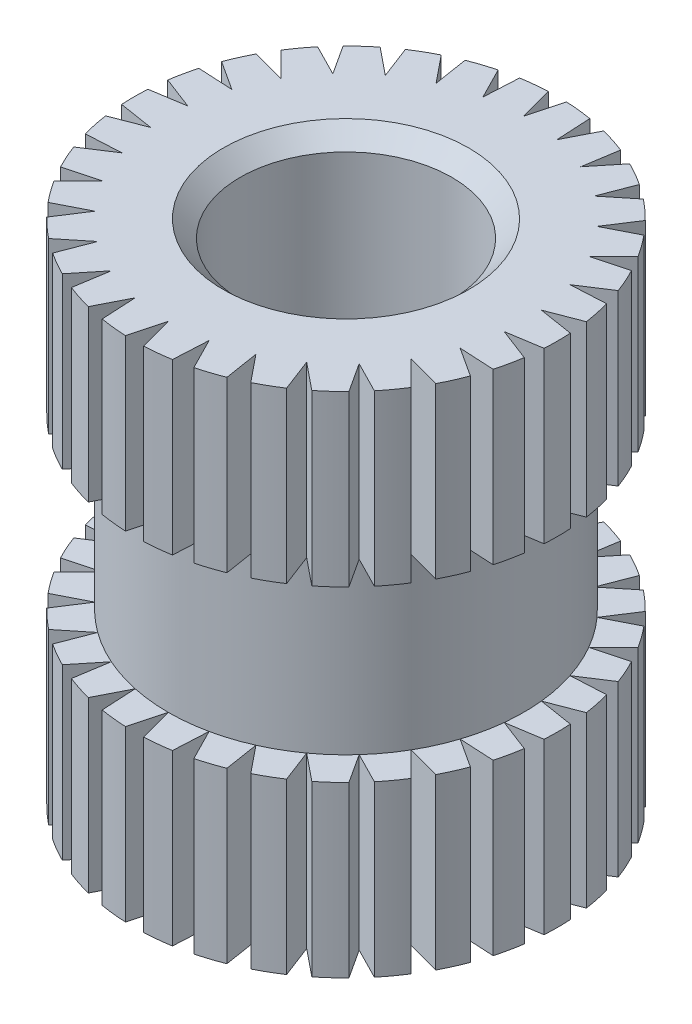
from build123d import *

# Parameters (mm, degrees)
CUT_EXTRUDE1_DEPTH = 10
CIRPATTERN1_COUNT  = 30
CHAMFER1_SIZE      = 0.2


with BuildPart() as part:
    # Sketch1 → Revolve1 (revolve)
    with BuildSketch(Plane(origin=(0, 0, 0), x_dir=(0, 0, -1), z_dir=(1, 0, 0)), mode=Mode.PRIVATE) as revolve1_sk:
        Polygon((2.1, -1), (2.5, -1), (2.5, -3), (1.25, -3), (1.25, 3), (2.5, 3), (2.5, 1), (2.1, 1), align=None)
    revolve(revolve1_sk.sketch.rotate(Axis((0, 5.73943662, 0), (0, -1, 0)), 180), axis=Axis((0, 5.73943662, 0), (0, -1, 0)))

    # Sketch2 → Cut-Extrude1 (cut)
    with BuildSketch(Plane(origin=(0, 3, 0), x_dir=(1, 0, 0), z_dir=(0, 1, 0))):
        Polygon((-0.241154273, 3), (0, 2.1), (0.241154273, 3), align=None)
    cut_extrude1 = extrude(amount=-CUT_EXTRUDE1_DEPTH, mode=Mode.SUBTRACT)

    # CirPattern1: Cut-Extrude1 ×30 about axis
    cirpattern1_axis = Axis((0, 0, 0), (0, 1, 0))
    for i in range(1, CIRPATTERN1_COUNT):
        add(cut_extrude1.rotate(cirpattern1_axis, i * 360 / CIRPATTERN1_COUNT), mode=Mode.SUBTRACT)

    # Chamfer1
    chamfer1_edges = [part.edges().sort_by_distance(p)[0] for p in [
        (0, 3, -1.25),
        (0, -3, -1.25),
    ]]
    chamfer(chamfer1_edges, length=CHAMFER1_SIZE)


solid = part.part
